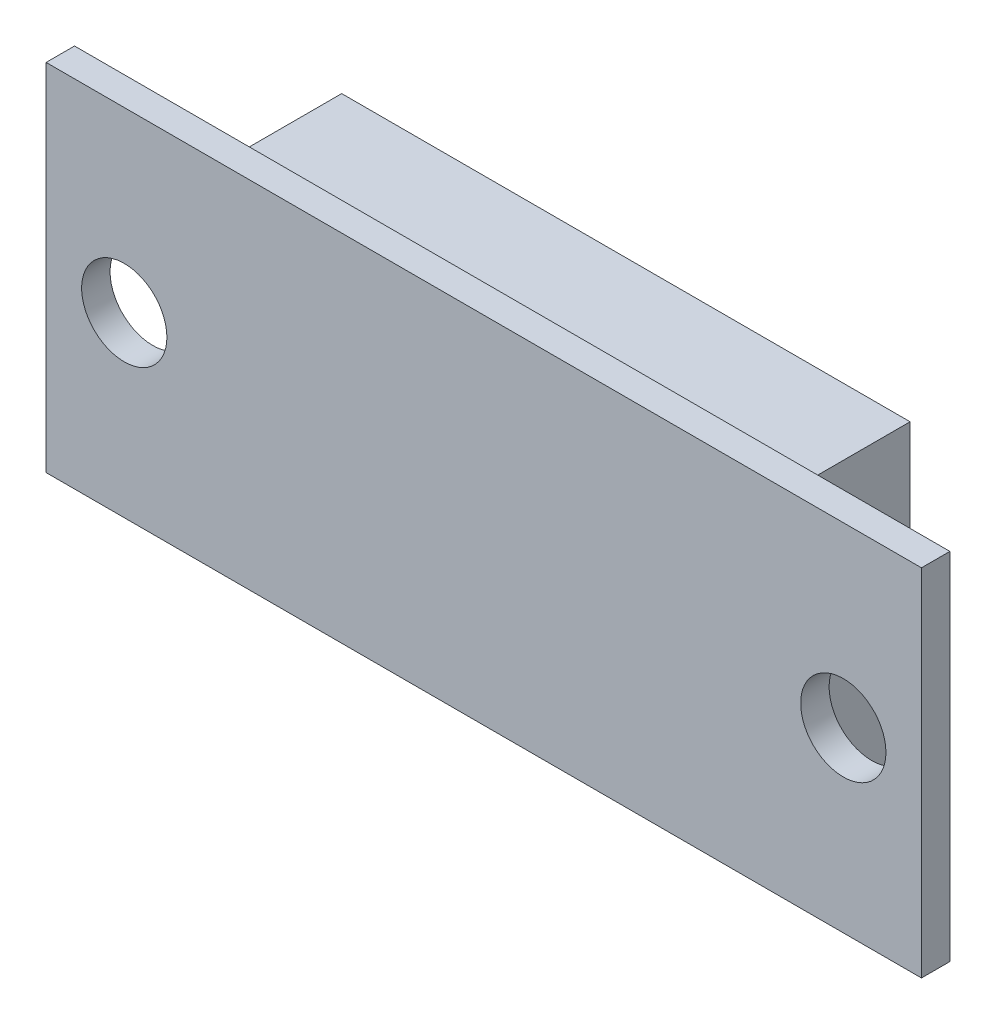
from build123d import *

# Parameters (mm, degrees)
SKETCH1_W                = 20
SKETCH1_H                = 11
BOSS_EXTRUDE1_DEPTH      = 4
SKETCH2_W                = 30.8
SKETCH2_H                = 12.5
BOSS_EXTRUDE2_DEPTH      = 1
F_3_0_3_DIAMETER_HOLE1_D = 3


with BuildPart() as part:
    # Sketch1 → Boss-Extrude1 (new body)
    with BuildSketch(Plane.XY):
        Rectangle(SKETCH1_W, SKETCH1_H)
    extrude(amount=BOSS_EXTRUDE1_DEPTH)

    # Sketch2 → Boss-Extrude2 (add)
    with BuildSketch(Plane.XY.offset(4)):
        Rectangle(SKETCH2_W, SKETCH2_H)
    extrude(amount=BOSS_EXTRUDE2_DEPTH)

    # Ø3.0 (3) Diameter Hole1 (through all)
    with Locations(Plane.XY.offset(5)):
        with Locations((-12.65, 0), (12.65, 0)):
            Hole(F_3_0_3_DIAMETER_HOLE1_D / 2)


solid = part.part
